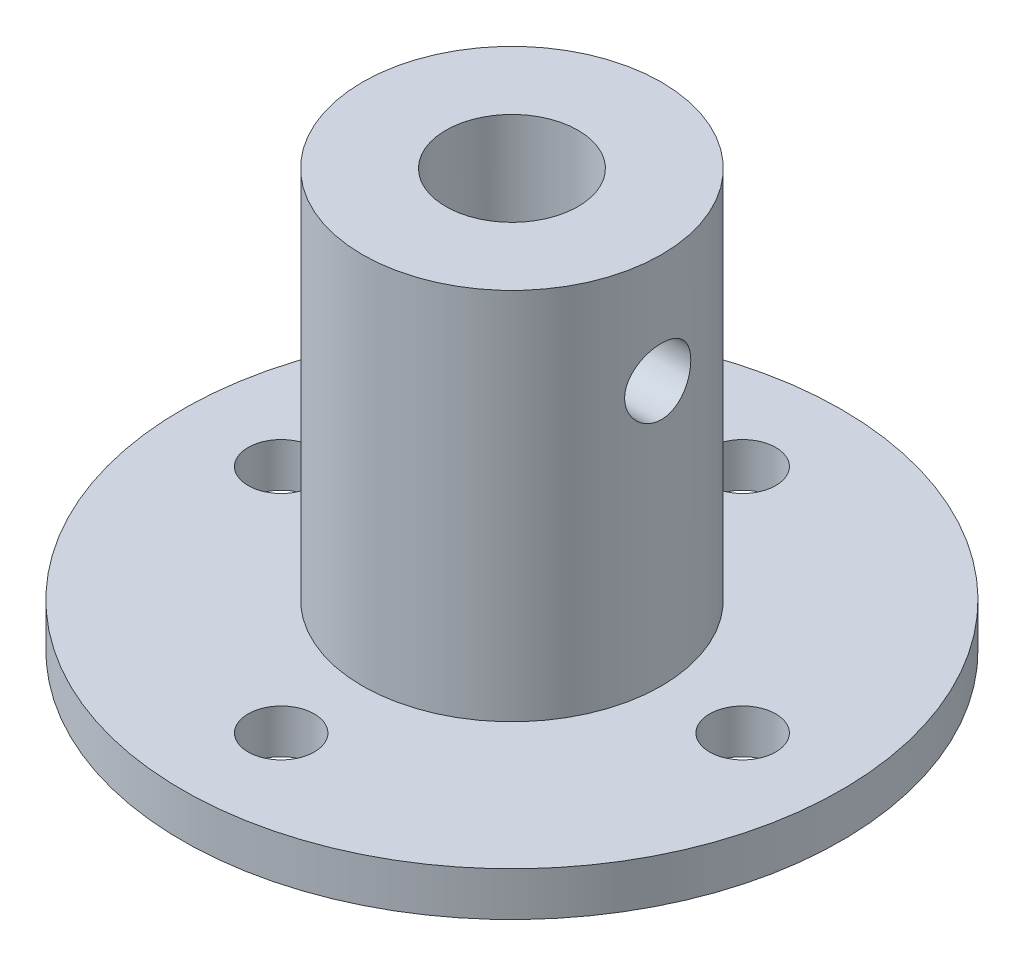
from build123d import *

# Parameters (mm, degrees)
CUT_EXTRUDE1_DEPTH      = 24.682289032
CUT_EXTRUDE1_DEPTH_BACK = 24.682289032
SKETCH1_5_R             = 1.1938
SKETCH2_R               = 1.1938
CUT_EXTRUDE2_DEPTH      = 24.682289102


with BuildPart() as part:
    # Sketch1 → Revolve1 (revolve)
    with BuildSketch(Plane(origin=(0, 0, 0), x_dir=(0, 0, -1), z_dir=(1, 0, 0))):
        Polygon((2.3876, 16.6624), (2.3876, 0), (3.9243, 0), (3.9243, 1.5875), (11.8999, 1.5875), (11.8999, 3.175), (5.3975, 3.175), (5.3975, 16.6624), align=None)
    revolve(axis=Axis((0, 0, 0), (0, 1, 0)))

    # Sketch1<5> → Cut-Extrude1 (cut, two sides: drawn at the far end of the back side and taken through both)
    with BuildSketch(Plane(origin=(0, 0, 0), x_dir=(0, 0, -1), z_dir=(1, 0, 0)).offset(-CUT_EXTRUDE1_DEPTH_BACK)):
        with Locations((0, 12.7)):
            Circle(SKETCH1_5_R)
    extrude(amount=CUT_EXTRUDE1_DEPTH + CUT_EXTRUDE1_DEPTH_BACK, mode=Mode.SUBTRACT)

    # Sketch2 → Cut-Extrude2 (cut, through all)
    with BuildSketch(Plane(origin=(0, 0, 0), x_dir=(1, 0, 0), z_dir=(0, 1, 0))):
        with Locations((-8.3312, 0)):
            Circle(SKETCH2_R)
        with Locations((0, 8.3312)):
            Circle(SKETCH2_R)
        with Locations((0, -8.3312)):
            Circle(SKETCH2_R)
        with Locations((8.3312, 0)):
            Circle(SKETCH2_R)
    extrude(amount=CUT_EXTRUDE2_DEPTH, mode=Mode.SUBTRACT)


solid = part.part
